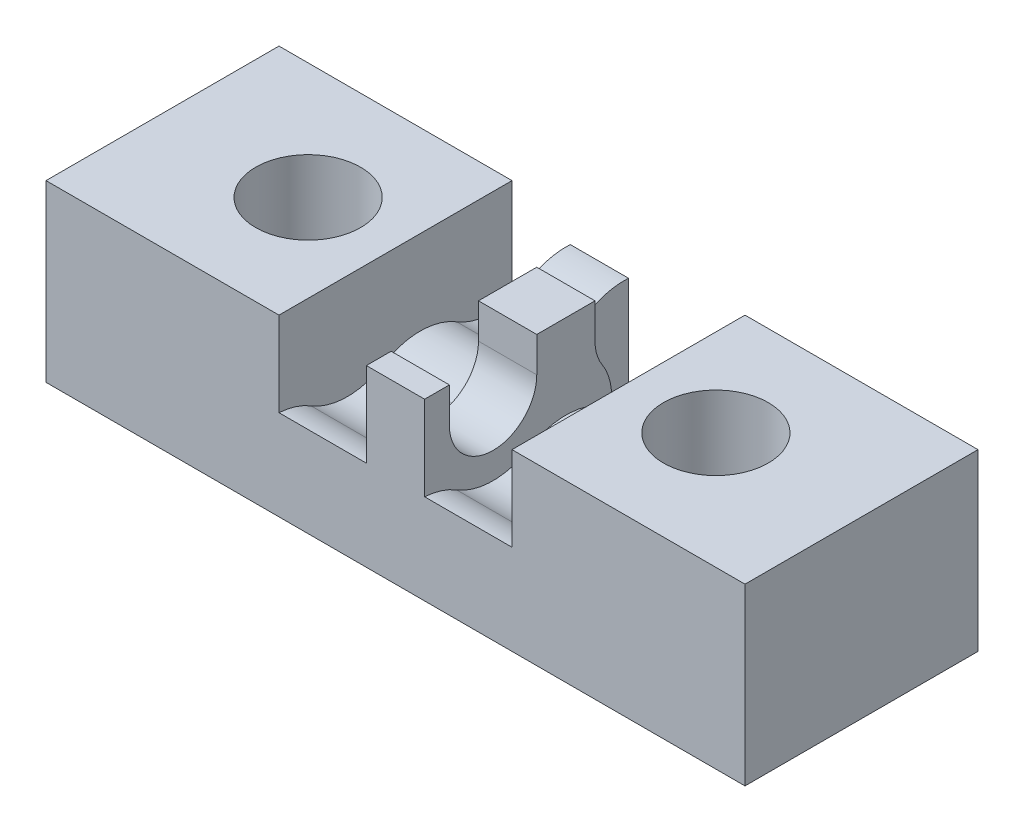
from build123d import *

# Parameters (mm, degrees)
SKETCH1_R           = 2.286
BOSS_EXTRUDE1_DEPTH = 7.62
CUT_EXTRUDE1_DEPTH  = 10.16
BOSS_EXTRUDE2_DEPTH = 1.27
SKETCH4_R           = 18.415
CUT_EXTRUDE2_DEPTH  = 2.54
FILLET1_R           = 2.54


with BuildPart() as part:
    # Sketch1 → Boss-Extrude1 (new body)
    with BuildSketch(Plane(origin=(0, 0, 0), x_dir=(1, 0, 0), z_dir=(0, 1, 0))):
        Polygon((5.08, 12.7), (-5.08, 12.7), (-5.08, 10.16), (-15.24, 10.16), (-15.24, 0), (15.24, 0), (15.24, 10.16), (5.08, 10.16), align=None)
        with Locations(Location((-8.89, 5.08, 0), (0, 0, 270))):
            Circle(SKETCH1_R, mode=Mode.SUBTRACT)
        with Locations(Location((8.89, 5.08, 0), (0, 0, 90))):
            Circle(SKETCH1_R, mode=Mode.SUBTRACT)
    extrude(amount=BOSS_EXTRUDE1_DEPTH)

    # Sketch2 → Cut-Extrude1 (cut)
    with BuildSketch(Plane(origin=(5.08, 0, 0), x_dir=(0, 0, -1), z_dir=(1, 0, 0))):
        with BuildLine():
            Line((2.9845, 9.144), (15.6845, 9.144))
            ThreePointArc((15.6845, 9.144), (18.618869601, 5.27151286), (14.097, 3.494049241))
            ThreePointArc((14.097, 3.494049241), (12.5095, 3.940098483), (10.922, 3.494049241))
            ThreePointArc((10.922, 3.494049241), (9.3345, 3.048), (7.747, 3.494049241))
            ThreePointArc((7.747, 3.494049241), (6.1595, 3.940098483), (4.572, 3.494049241))
            ThreePointArc((4.572, 3.494049241), (2.9845, 3.048), (1.397, 3.494049241))
            ThreePointArc((1.397, 3.494049241), (-0.1905, 3.940098483), (-1.778, 3.494049241))
            ThreePointArc((-1.778, 3.494049241), (-2.54101286, 3.161630399), (-3.3655, 3.048))
            Line((-3.3655, 3.048), (-3.3655, 9.144))
            Line((-3.3655, 9.144), (2.9845, 9.144))
        make_face()
    extrude(amount=-CUT_EXTRUDE1_DEPTH, mode=Mode.SUBTRACT)

    # Sketch3 → Boss-Extrude2 (add, symmetric)
    with BuildSketch(Plane(origin=(0, 0, 0), x_dir=(0, 0, -1), z_dir=(1, 0, 0))):
        with BuildLine():
            Line((4.8895, 7.62), (4.8895, 6.096))
            ThreePointArc((4.8895, 6.096), (2.9845, 4.191), (1.0795, 6.096))
            Line((1.0795, 6.096), (1.0795, 7.62))
            Line((1.0795, 7.62), (0, 7.62))
            Line((0, 7.62), (0, 3.934139533))
            ThreePointArc((0, 3.934139533), (0.725327968, 3.799255708), (1.397, 3.494049241))
            ThreePointArc((1.397, 3.494049241), (2.9845, 3.048), (4.572, 3.494049241))
            ThreePointArc((4.572, 3.494049241), (6.1595, 3.940098483), (7.747, 3.494049241))
            ThreePointArc((7.747, 3.494049241), (9.3345, 3.048), (10.922, 3.494049241))
            ThreePointArc((10.922, 3.494049241), (11.777159836, 3.850811359), (12.7, 3.934139533))
            Line((12.7, 3.934139533), (12.7, 7.62))
            Line((12.7, 7.62), (11.2395, 7.62))
            Line((11.2395, 7.62), (11.2395, 6.096))
            ThreePointArc((11.2395, 6.096), (9.3345, 4.191), (7.4295, 6.096))
            Line((7.4295, 6.096), (7.4295, 7.62))
            Line((7.4295, 7.62), (4.8895, 7.62))
        make_face()
    extrude(amount=BOSS_EXTRUDE2_DEPTH, both=True)

    # Sketch4 → Cut-Extrude2 (cut, symmetric)
    with BuildSketch(Plane(origin=(0, 0, 0), x_dir=(0, 0, -1), z_dir=(1, 0, 0))):
        with Locations((21.336, -10.18977017)):
            Circle(SKETCH4_R)
    extrude(amount=CUT_EXTRUDE2_DEPTH, both=True, mode=Mode.SUBTRACT)


with BuildPart() as cut_extrude2_kept_piece:
    # of the separate pieces the step leaves, the one the design keeps (cut_extrude2_pieces_kept)
    add(part.part.solids().sort_by_distance((5.08, 0, -12.7))[0])

    # Fillet1
    fillet1_edges = [cut_extrude2_kept_piece.edges().sort_by_distance(p)[0] for p in [
        (0, 4.301003177, -9.972474456),
    ]]
    fillet(fillet1_edges, radius=FILLET1_R)


solid = cut_extrude2_kept_piece.part
